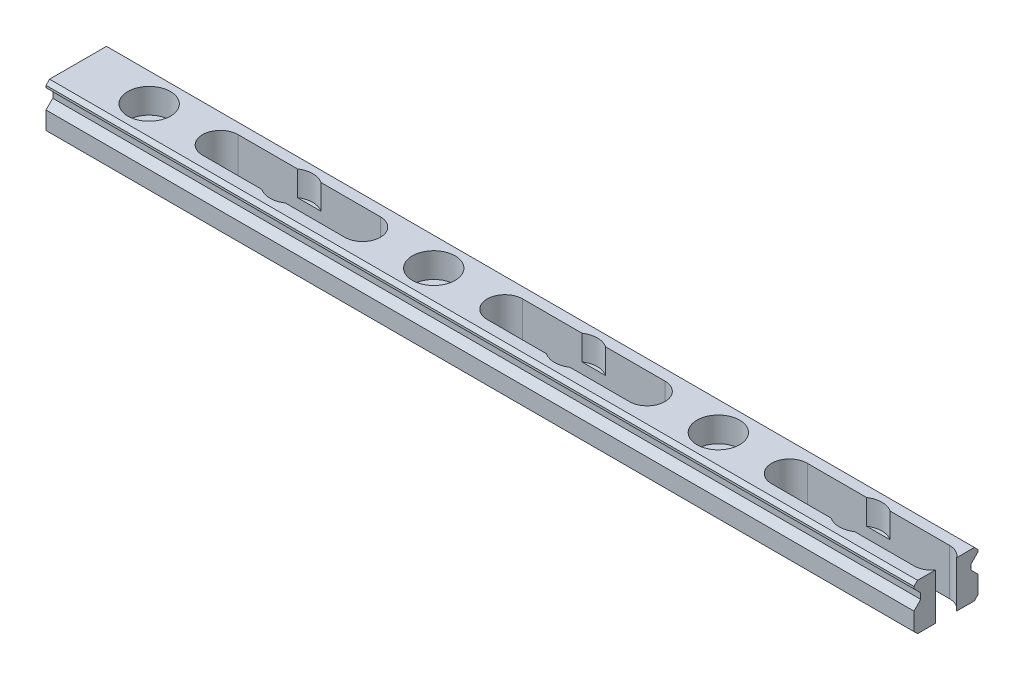
from build123d import *

# Parameters (mm, degrees)
SKETCH_1_W            = 9
SKETCH_1_H            = 6.5
EXTRUDE_1_DEPTH       = 122
SKETCH_2_R            = 1.75
CUT_EXTRUDE_2_DEPTH   = 8
SKETCH_3_R            = 3
CUT_EXTRUDE_3_DEPTH   = 3.5
CHAMFER_1_SIZE        = 0.5
CUT_EXTRUDE_2_2_DEPTH = 123.126215449
CUT_EXTRUDE_3_2_DEPTH = 10


with BuildPart() as part:
    # 草图1 → 拉伸1 (new body)
    with BuildSketch(Plane(origin=(0, 0, 0), x_dir=(0, 0, -1), z_dir=(1, 0, 0))):
        Rectangle(SKETCH_1_W, SKETCH_1_H)
    extrude(amount=EXTRUDE_1_DEPTH)

    # 草图2 → Cut-Extrude 2 (cut)
    with BuildSketch(Plane.XZ.offset(3.25)):
        with Locations(Location((10, 0, 0), (0, 0, 270))):
            Circle(SKETCH_2_R)
        with Locations(Location((30, 0, 0), (0, 0, 270))):
            Circle(SKETCH_2_R)
        with Locations(Location((50, 0, 0), (0, 0, 270))):
            Circle(SKETCH_2_R)
        with Locations(Location((70, 0, 0), (0, 0, 270))):
            Circle(SKETCH_2_R)
        with Locations(Location((90, 0, 0), (0, 0, 270))):
            Circle(SKETCH_2_R)
        with Locations(Location((110, 0, 0), (0, 0, 270))):
            Circle(SKETCH_2_R)
        with Locations((130, 0)):
            Circle(SKETCH_2_R)
        with Locations((150, 0)):
            Circle(SKETCH_2_R)
        with Locations((170, 0)):
            Circle(SKETCH_2_R)
        with Locations((190, 0)):
            Circle(SKETCH_2_R)
        with Locations((210, 0)):
            Circle(SKETCH_2_R)
        with Locations((230, 0)):
            Circle(SKETCH_2_R)
        with Locations((250, 0)):
            Circle(SKETCH_2_R)
        with Locations((270, 0)):
            Circle(SKETCH_2_R)
        with Locations((290, 0)):
            Circle(SKETCH_2_R)
        with Locations((310, 0)):
            Circle(SKETCH_2_R)
        with Locations((330, 0)):
            Circle(SKETCH_2_R)
        with Locations((350, 0)):
            Circle(SKETCH_2_R)
        with Locations((370, 0)):
            Circle(SKETCH_2_R)
        with Locations((390, 0)):
            Circle(SKETCH_2_R)
        with Locations((410, 0)):
            Circle(SKETCH_2_R)
        with Locations((430, 0)):
            Circle(SKETCH_2_R)
        with Locations((450, 0)):
            Circle(SKETCH_2_R)
        with Locations((470, 0)):
            Circle(SKETCH_2_R)
        with Locations((490, 0)):
            Circle(SKETCH_2_R)
        with Locations((510, 0)):
            Circle(SKETCH_2_R)
        with Locations((530, 0)):
            Circle(SKETCH_2_R)
        with Locations((550, 0)):
            Circle(SKETCH_2_R)
        with Locations((570, 0)):
            Circle(SKETCH_2_R)
        with Locations((590, 0)):
            Circle(SKETCH_2_R)
        with Locations((610, 0)):
            Circle(SKETCH_2_R)
        with Locations((630, 0)):
            Circle(SKETCH_2_R)
        with Locations((650, 0)):
            Circle(SKETCH_2_R)
        with Locations((670, 0)):
            Circle(SKETCH_2_R)
        with Locations((690, 0)):
            Circle(SKETCH_2_R)
        with Locations((710, 0)):
            Circle(SKETCH_2_R)
        with Locations((730, 0)):
            Circle(SKETCH_2_R)
        with Locations((750, 0)):
            Circle(SKETCH_2_R)
        with Locations((770, 0)):
            Circle(SKETCH_2_R)
        with Locations((790, 0)):
            Circle(SKETCH_2_R)
        with Locations((810, 0)):
            Circle(SKETCH_2_R)
        with Locations((830, 0)):
            Circle(SKETCH_2_R)
        with Locations((850, 0)):
            Circle(SKETCH_2_R)
        with Locations((870, 0)):
            Circle(SKETCH_2_R)
        with Locations((890, 0)):
            Circle(SKETCH_2_R)
        with Locations((910, 0)):
            Circle(SKETCH_2_R)
        with Locations((930, 0)):
            Circle(SKETCH_2_R)
        with Locations((950, 0)):
            Circle(SKETCH_2_R)
        with Locations((970, 0)):
            Circle(SKETCH_2_R)
        with Locations((990, 0)):
            Circle(SKETCH_2_R)
        with Locations((1010, 0)):
            Circle(SKETCH_2_R)
        with Locations((1030, 0)):
            Circle(SKETCH_2_R)
        with Locations((1050, 0)):
            Circle(SKETCH_2_R)
        with Locations((1070, 0)):
            Circle(SKETCH_2_R)
        with Locations((1090, 0)):
            Circle(SKETCH_2_R)
        with Locations((1110, 0)):
            Circle(SKETCH_2_R)
        with Locations((1130, 0)):
            Circle(SKETCH_2_R)
        with Locations((1150, 0)):
            Circle(SKETCH_2_R)
        with Locations((1170, 0)):
            Circle(SKETCH_2_R)
        with Locations((1190, 0)):
            Circle(SKETCH_2_R)
    extrude(amount=-CUT_EXTRUDE_2_DEPTH, mode=Mode.SUBTRACT)

    # 草图3 → Cut-Extrude 3 (cut)
    with BuildSketch(Plane.XZ.offset(-3.25)):
        with Locations(Location((10, 0, 0), (0, 0, 270))):
            Circle(SKETCH_3_R)
        with Locations(Location((30, 0, 0), (0, 0, 270))):
            Circle(SKETCH_3_R)
        with Locations(Location((50, 0, 0), (0, 0, 270))):
            Circle(SKETCH_3_R)
        with Locations(Location((70, 0, 0), (0, 0, 270))):
            Circle(SKETCH_3_R)
        with Locations(Location((90, 0, 0), (0, 0, 270))):
            Circle(SKETCH_3_R)
        with Locations(Location((110, 0, 0), (0, 0, 270))):
            Circle(SKETCH_3_R)
        with Locations((130, 0)):
            Circle(SKETCH_3_R)
        with Locations((150, 0)):
            Circle(SKETCH_3_R)
        with Locations((170, 0)):
            Circle(SKETCH_3_R)
        with Locations((190, 0)):
            Circle(SKETCH_3_R)
        with Locations((210, 0)):
            Circle(SKETCH_3_R)
        with Locations((230, 0)):
            Circle(SKETCH_3_R)
        with Locations((250, 0)):
            Circle(SKETCH_3_R)
        with Locations((270, 0)):
            Circle(SKETCH_3_R)
        with Locations((290, 0)):
            Circle(SKETCH_3_R)
        with Locations((310, 0)):
            Circle(SKETCH_3_R)
        with Locations((330, 0)):
            Circle(SKETCH_3_R)
        with Locations((350, 0)):
            Circle(SKETCH_3_R)
        with Locations((370, 0)):
            Circle(SKETCH_3_R)
        with Locations((390, 0)):
            Circle(SKETCH_3_R)
        with Locations((410, 0)):
            Circle(SKETCH_3_R)
        with Locations((430, 0)):
            Circle(SKETCH_3_R)
        with Locations((450, 0)):
            Circle(SKETCH_3_R)
        with Locations((470, 0)):
            Circle(SKETCH_3_R)
        with Locations((490, 0)):
            Circle(SKETCH_3_R)
        with Locations((510, 0)):
            Circle(SKETCH_3_R)
        with Locations((530, 0)):
            Circle(SKETCH_3_R)
        with Locations((550, 0)):
            Circle(SKETCH_3_R)
        with Locations((570, 0)):
            Circle(SKETCH_3_R)
        with Locations((590, 0)):
            Circle(SKETCH_3_R)
        with Locations((610, 0)):
            Circle(SKETCH_3_R)
        with Locations((630, 0)):
            Circle(SKETCH_3_R)
        with Locations((650, 0)):
            Circle(SKETCH_3_R)
        with Locations((670, 0)):
            Circle(SKETCH_3_R)
        with Locations((690, 0)):
            Circle(SKETCH_3_R)
        with Locations((710, 0)):
            Circle(SKETCH_3_R)
        with Locations((730, 0)):
            Circle(SKETCH_3_R)
        with Locations((750, 0)):
            Circle(SKETCH_3_R)
        with Locations((770, 0)):
            Circle(SKETCH_3_R)
        with Locations((790, 0)):
            Circle(SKETCH_3_R)
        with Locations((810, 0)):
            Circle(SKETCH_3_R)
        with Locations((830, 0)):
            Circle(SKETCH_3_R)
        with Locations((850, 0)):
            Circle(SKETCH_3_R)
        with Locations((870, 0)):
            Circle(SKETCH_3_R)
        with Locations((890, 0)):
            Circle(SKETCH_3_R)
        with Locations((910, 0)):
            Circle(SKETCH_3_R)
        with Locations((930, 0)):
            Circle(SKETCH_3_R)
        with Locations((950, 0)):
            Circle(SKETCH_3_R)
        with Locations((970, 0)):
            Circle(SKETCH_3_R)
        with Locations((990, 0)):
            Circle(SKETCH_3_R)
        with Locations((1010, 0)):
            Circle(SKETCH_3_R)
        with Locations((1030, 0)):
            Circle(SKETCH_3_R)
        with Locations((1050, 0)):
            Circle(SKETCH_3_R)
        with Locations((1070, 0)):
            Circle(SKETCH_3_R)
        with Locations((1090, 0)):
            Circle(SKETCH_3_R)
        with Locations((1110, 0)):
            Circle(SKETCH_3_R)
        with Locations((1130, 0)):
            Circle(SKETCH_3_R)
        with Locations((1150, 0)):
            Circle(SKETCH_3_R)
        with Locations((1170, 0)):
            Circle(SKETCH_3_R)
        with Locations((1190, 0)):
            Circle(SKETCH_3_R)
    extrude(amount=CUT_EXTRUDE_3_DEPTH, mode=Mode.SUBTRACT)

    # 倒角1
    chamfer_1_edges = [part.edges().sort_by_distance(p)[0] for p in [
        (61, 3.25, 4.5),
        (61, 3.25, -4.5),
        (61, -3.25, -4.5),
        (61, -3.25, 4.5),
    ]]
    chamfer(chamfer_1_edges, length=CHAMFER_1_SIZE)

    # 草图4 → Cut-Extrude 2 2 (cut, through all)
    with BuildSketch(Plane.ZY):
        Polygon((-4.5, 2.45), (-4.5, -0.25), (-3.55, 0.7), (-3.55, 1.5), align=None)
        Polygon((4.5, 2.45), (4.5, -0.25), (3.55, 0.7), (3.55, 1.5), align=None)
    extrude(amount=-CUT_EXTRUDE_2_2_DEPTH, mode=Mode.SUBTRACT)

    # 草图5 → Cut-Extrude 3 2 (cut)
    with BuildSketch(Plane(origin=(0, 3.25, 0), x_dir=(1, 0, 0), z_dir=(0, 1, 0))):
        with BuildLine():
            Line((60, -2.5), (80, -2.5))
            ThreePointArc((80, -2.5), (82.5, 0), (80, 2.5))
            Line((80, 2.5), (60, 2.5))
            ThreePointArc((60, 2.5), (57.5, 0), (60, -2.5))
        make_face()
        with BuildLine():
            Line((20, -2.5), (40, -2.5))
            ThreePointArc((40, -2.5), (42.5, 0), (40, 2.5))
            Line((40, 2.5), (20, 2.5))
            ThreePointArc((20, 2.5), (17.5, 0), (20, -2.5))
        make_face()
        with BuildLine():
            Line((100, -2.5), (120, -2.5))
            ThreePointArc((120, -2.5), (122.5, 0), (120, 2.5))
            Line((120, 2.5), (100, 2.5))
            ThreePointArc((100, 2.5), (97.5, 0), (100, -2.5))
        make_face()
        with BuildLine():
            Line((140, -2.5), (160, -2.5))
            ThreePointArc((160, -2.5), (162.5, 0), (160, 2.5))
            Line((160, 2.5), (140, 2.5))
            ThreePointArc((140, 2.5), (137.5, 0), (140, -2.5))
        make_face()
        with BuildLine():
            Line((180, -2.5), (200, -2.5))
            ThreePointArc((200, -2.5), (202.5, 0), (200, 2.5))
            Line((200, 2.5), (180, 2.5))
            ThreePointArc((180, 2.5), (177.5, 0), (180, -2.5))
        make_face()
        with BuildLine():
            Line((220, -2.5), (240, -2.5))
            ThreePointArc((240, -2.5), (242.5, 0), (240, 2.5))
            Line((240, 2.5), (220, 2.5))
            ThreePointArc((220, 2.5), (217.5, 0), (220, -2.5))
        make_face()
        with BuildLine():
            Line((260, -2.5), (280, -2.5))
            ThreePointArc((280, -2.5), (282.5, 0), (280, 2.5))
            Line((280, 2.5), (260, 2.5))
            ThreePointArc((260, 2.5), (257.5, 0), (260, -2.5))
        make_face()
        with BuildLine():
            Line((300, -2.5), (320, -2.5))
            ThreePointArc((320, -2.5), (322.5, 0), (320, 2.5))
            Line((320, 2.5), (300, 2.5))
            ThreePointArc((300, 2.5), (297.5, 0), (300, -2.5))
        make_face()
        with BuildLine():
            Line((340, -2.5), (360, -2.5))
            ThreePointArc((360, -2.5), (362.5, 0), (360, 2.5))
            Line((360, 2.5), (340, 2.5))
            ThreePointArc((340, 2.5), (337.5, 0), (340, -2.5))
        make_face()
        with BuildLine():
            Line((380, -2.5), (400, -2.5))
            ThreePointArc((400, -2.5), (402.5, 0), (400, 2.5))
            Line((400, 2.5), (380, 2.5))
            ThreePointArc((380, 2.5), (377.5, 0), (380, -2.5))
        make_face()
        with BuildLine():
            Line((420, -2.5), (440, -2.5))
            ThreePointArc((440, -2.5), (442.5, 0), (440, 2.5))
            Line((440, 2.5), (420, 2.5))
            ThreePointArc((420, 2.5), (417.5, 0), (420, -2.5))
        make_face()
        with BuildLine():
            Line((460, -2.5), (480, -2.5))
            ThreePointArc((480, -2.5), (482.5, 0), (480, 2.5))
            Line((480, 2.5), (460, 2.5))
            ThreePointArc((460, 2.5), (457.5, 0), (460, -2.5))
        make_face()
        with BuildLine():
            Line((500, -2.5), (520, -2.5))
            ThreePointArc((520, -2.5), (522.5, 0), (520, 2.5))
            Line((520, 2.5), (500, 2.5))
            ThreePointArc((500, 2.5), (497.5, 0), (500, -2.5))
        make_face()
        with BuildLine():
            Line((540, -2.5), (560, -2.5))
            ThreePointArc((560, -2.5), (562.5, 0), (560, 2.5))
            Line((560, 2.5), (540, 2.5))
            ThreePointArc((540, 2.5), (537.5, 0), (540, -2.5))
        make_face()
        with BuildLine():
            Line((580, -2.5), (600, -2.5))
            ThreePointArc((600, -2.5), (602.5, 0), (600, 2.5))
            Line((600, 2.5), (580, 2.5))
            ThreePointArc((580, 2.5), (577.5, 0), (580, -2.5))
        make_face()
        with BuildLine():
            Line((620, -2.5), (640, -2.5))
            ThreePointArc((640, -2.5), (642.5, 0), (640, 2.5))
            Line((640, 2.5), (620, 2.5))
            ThreePointArc((620, 2.5), (617.5, 0), (620, -2.5))
        make_face()
        with BuildLine():
            Line((660, -2.5), (680, -2.5))
            ThreePointArc((680, -2.5), (682.5, 0), (680, 2.5))
            Line((680, 2.5), (660, 2.5))
            ThreePointArc((660, 2.5), (657.5, 0), (660, -2.5))
        make_face()
        with BuildLine():
            Line((700, -2.5), (720, -2.5))
            ThreePointArc((720, -2.5), (722.5, 0), (720, 2.5))
            Line((720, 2.5), (700, 2.5))
            ThreePointArc((700, 2.5), (697.5, 0), (700, -2.5))
        make_face()
        with BuildLine():
            Line((740, -2.5), (760, -2.5))
            ThreePointArc((760, -2.5), (762.5, 0), (760, 2.5))
            Line((760, 2.5), (740, 2.5))
            ThreePointArc((740, 2.5), (737.5, 0), (740, -2.5))
        make_face()
        with BuildLine():
            Line((780, -2.5), (800, -2.5))
            ThreePointArc((800, -2.5), (802.5, 0), (800, 2.5))
            Line((800, 2.5), (780, 2.5))
            ThreePointArc((780, 2.5), (777.5, 0), (780, -2.5))
        make_face()
        with BuildLine():
            Line((820, -2.5), (840, -2.5))
            ThreePointArc((840, -2.5), (842.5, 0), (840, 2.5))
            Line((840, 2.5), (820, 2.5))
            ThreePointArc((820, 2.5), (817.5, 0), (820, -2.5))
        make_face()
        with BuildLine():
            Line((860, -2.5), (880, -2.5))
            ThreePointArc((880, -2.5), (882.5, 0), (880, 2.5))
            Line((880, 2.5), (860, 2.5))
            ThreePointArc((860, 2.5), (857.5, 0), (860, -2.5))
        make_face()
        with BuildLine():
            Line((900, -2.5), (920, -2.5))
            ThreePointArc((920, -2.5), (922.5, 0), (920, 2.5))
            Line((920, 2.5), (900, 2.5))
            ThreePointArc((900, 2.5), (897.5, 0), (900, -2.5))
        make_face()
        with BuildLine():
            Line((940, -2.5), (960, -2.5))
            ThreePointArc((960, -2.5), (962.5, 0), (960, 2.5))
            Line((960, 2.5), (940, 2.5))
            ThreePointArc((940, 2.5), (937.5, 0), (940, -2.5))
        make_face()
        with BuildLine():
            Line((980, -2.5), (1000, -2.5))
            ThreePointArc((1000, -2.5), (1002.5, 0), (1000, 2.5))
            Line((1000, 2.5), (980, 2.5))
            ThreePointArc((980, 2.5), (977.5, 0), (980, -2.5))
        make_face()
        with BuildLine():
            Line((1020, -2.5), (1040, -2.5))
            ThreePointArc((1040, -2.5), (1042.5, 0), (1040, 2.5))
            Line((1040, 2.5), (1020, 2.5))
            ThreePointArc((1020, 2.5), (1017.5, 0), (1020, -2.5))
        make_face()
        with BuildLine():
            Line((1060, -2.5), (1080, -2.5))
            ThreePointArc((1080, -2.5), (1082.5, 0), (1080, 2.5))
            Line((1080, 2.5), (1060, 2.5))
            ThreePointArc((1060, 2.5), (1057.5, 0), (1060, -2.5))
        make_face()
        with BuildLine():
            Line((1100, -2.5), (1120, -2.5))
            ThreePointArc((1120, -2.5), (1122.5, 0), (1120, 2.5))
            Line((1120, 2.5), (1100, 2.5))
            ThreePointArc((1100, 2.5), (1097.5, 0), (1100, -2.5))
        make_face()
        with BuildLine():
            Line((1140, -2.5), (1160, -2.5))
            ThreePointArc((1160, -2.5), (1162.5, 0), (1160, 2.5))
            Line((1160, 2.5), (1140, 2.5))
            ThreePointArc((1140, 2.5), (1137.5, 0), (1140, -2.5))
        make_face()
    extrude(amount=-CUT_EXTRUDE_3_2_DEPTH, mode=Mode.SUBTRACT)


solid = part.part
